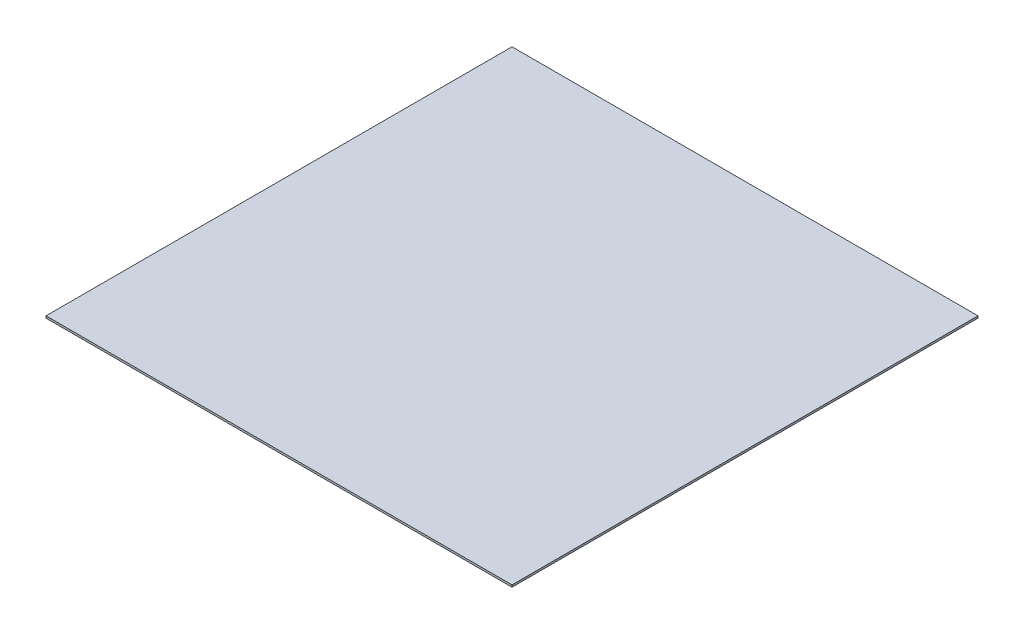
from build123d import *

# Parameters (mm, degrees)
SKETCH1_W           = 300
SKETCH1_H           = 300
BOSS_EXTRUDE1_DEPTH = 1.3


with BuildPart() as part:
    # Sketch1 → Boss-Extrude1 (new body)
    with BuildSketch(Plane(origin=(0, 0, 0), x_dir=(1, 0, 0), z_dir=(0, 1, 0))):
        Rectangle(SKETCH1_W, SKETCH1_H)
    extrude(amount=BOSS_EXTRUDE1_DEPTH)


solid = part.part
